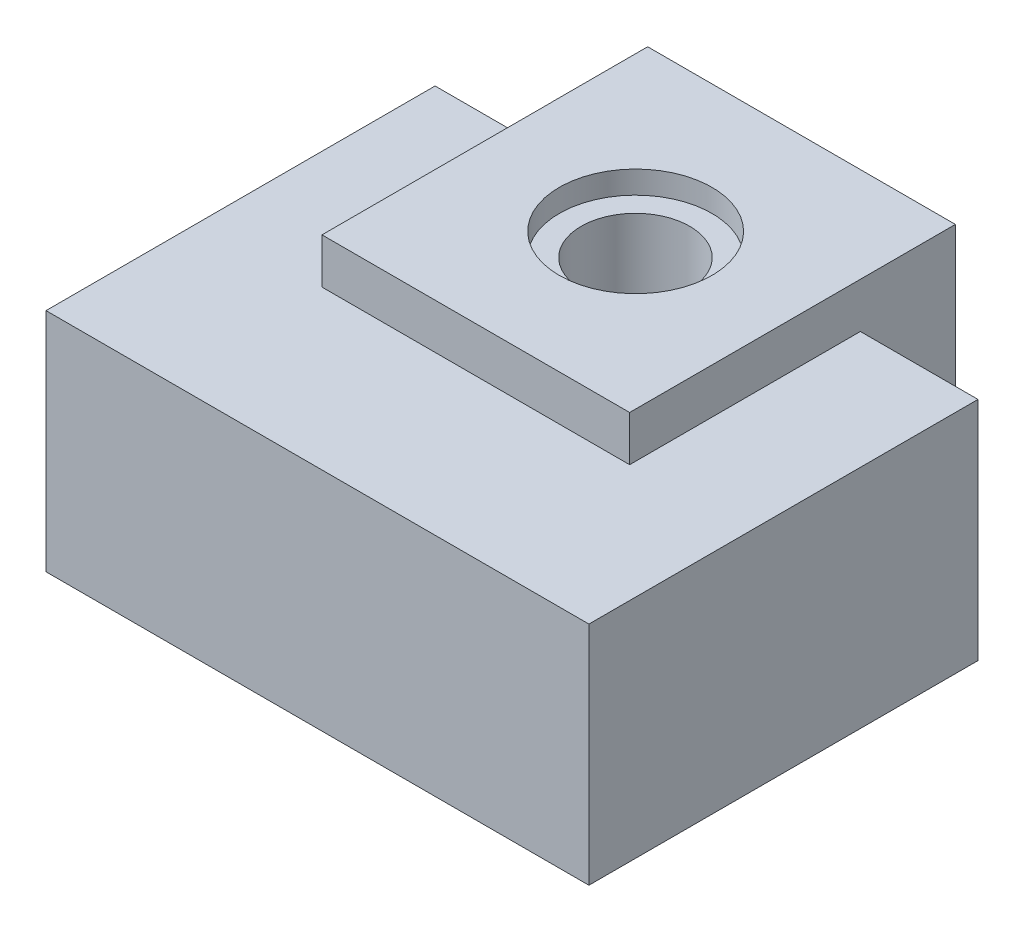
from build123d import *

# Parameters (mm, degrees)
SKETCH1_W           = 60
SKETCH1_H           = 43
BOSS_EXTRUDE1_DEPTH = 25
SKETCH2_W           = 34
SKETCH2_H           = 25.5
BOSS_EXTRUDE2_DEPTH = 5
SKETCH5_W           = 34.00729927
SKETCH5_H           = 30
BOSS_EXTRUDE3_DEPTH = 10.5
SKETCH6_R           = 6
CUT_EXTRUDE1_DEPTH  = 86.803554705
SKETCH7_R           = 8.437552617
SKETCH7_R_2         = 5.978835127
CUT_EXTRUDE2_DEPTH  = 2.5


with BuildPart() as part:
    # Sketch1 → Boss-Extrude1 (new body)
    with BuildSketch(Plane(origin=(0, 0, 0), x_dir=(1, 0, 0), z_dir=(0, 1, 0))):
        with Locations((30, 21.5)):
            Rectangle(SKETCH1_W, SKETCH1_H)
    extrude(amount=BOSS_EXTRUDE1_DEPTH)

    # Sketch2 → Boss-Extrude2 (add)
    with BuildSketch(Plane(origin=(0, 25, 0), x_dir=(1, 0, 0), z_dir=(0, 1, 0))):
        with Locations((30, 30.25)):
            Rectangle(SKETCH2_W, SKETCH2_H)
    extrude(amount=BOSS_EXTRUDE2_DEPTH)

    # Sketch5 → Boss-Extrude3 (add)
    with BuildSketch(Plane(origin=(0, 0, -43), x_dir=(-1, 0, 0), z_dir=(0, 0, -1))):
        with Locations((-29.996350365, 15)):
            Rectangle(SKETCH5_W, SKETCH5_H)
    extrude(amount=BOSS_EXTRUDE3_DEPTH)

    # Sketch6 → Cut-Extrude1 (cut, through all)
    with BuildSketch(Plane(origin=(0, 30, 0), x_dir=(1, 0, 0), z_dir=(0, 1, 0))):
        with Locations(Location((29.998211201, 35.144717579, 0), (0, 0, 270))):
            Circle(SKETCH6_R)
    extrude(amount=-CUT_EXTRUDE1_DEPTH, mode=Mode.SUBTRACT)

    # Sketch7 → Cut-Extrude2 (cut, symmetric)
    with BuildSketch(Plane(origin=(0, 30, 0), x_dir=(1, 0, 0), z_dir=(0, 1, 0))):
        with Locations(Location((29.998209055, 35.165882453, 0), (0, 0, 270))):
            Circle(SKETCH7_R)
        with Locations((29.998209055, 35.165882453)):
            Circle(SKETCH7_R_2, mode=Mode.SUBTRACT)
    extrude(amount=CUT_EXTRUDE2_DEPTH, both=True, mode=Mode.SUBTRACT)


solid = part.part
